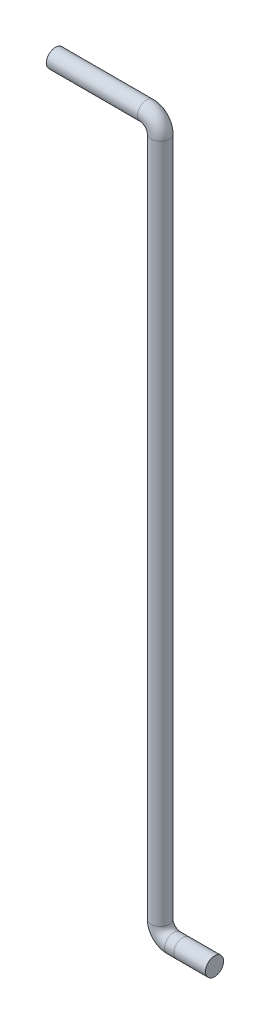
from build123d import *

# Parameters (mm, degrees)
SKETCH2_R = 1


with BuildPart() as part:
    # Sweep1: sweep along a path in Sketch1
    with BuildLine(Plane.XY) as sweep1_path:
        Line((-17.55, 78), (-7.5, 78))
        ThreePointArc((-7.5, 78), (-6.439339828, 77.560660172), (-6, 76.5))
        Line((-6, 76.5), (-6, 1.5))
        ThreePointArc((-6, 1.5), (-5.560660172, 0.439339828), (-4.5, 0))
        Line((-4.5, 0), (-3.5, 0))
        Line((-3.5, 0), (0, 0))
    # Sketch2 → Sweep1 (sweep)
    with BuildSketch(Plane(origin=(0, 0, 0), x_dir=(0, 0, -1), z_dir=(1, 0, 0))):
        Circle(SKETCH2_R)
    sweep(path=sweep1_path.line)


solid = part.part
